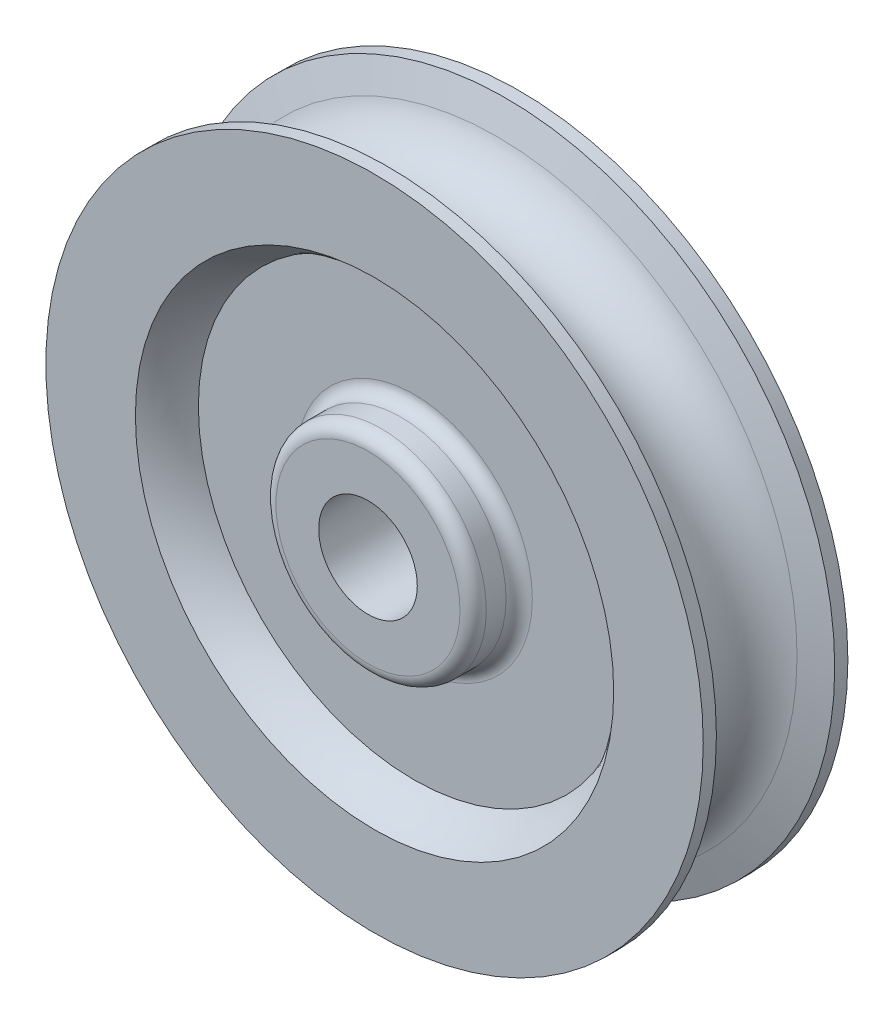
from build123d import *


with BuildPart() as part:
    # Sketch1 → Revolve1 (revolve)
    with BuildSketch(Plane(origin=(0, 0, 0), x_dir=(1, 0, 0), z_dir=(0, 1, 0))):
        with BuildLine():
            ThreePointArc((32.801315846, 17), (34.259680647, 20.197781656), (36.381049961, 23))
            Line((36.381049961, 23), (49.999989289, 23))
            Line((49.999989289, 23), (49.999989289, 21.000034438))
            Line((49.999989289, 21.000034438), (45.624111056, 19.639054374))
            ThreePointArc((45.624111056, 19.639054374), (40, 12), (45.624111056, 4.360945626))
            Line((45.624111056, 4.360945626), (49.999989289, 2.999965562))
            Line((49.999989289, 2.999965562), (49.999989289, 1))
            Line((49.999989289, 1), (36.381049961, 1))
            ThreePointArc((36.381049961, 1), (34.259680647, 3.802218344), (32.801315846, 7))
            Line((32.801315846, 7), (18, 7))
            ThreePointArc((18, 7), (16.585786438, 6.414213562), (16, 5))
            Line((16, 5), (16, 2))
            ThreePointArc((16, 2), (15.414213562, 0.585786438), (14, 0))
            Line((14, 0), (7.5, 0))
            Line((7.5, 0), (7.5, 12))
            Line((7.5, 12), (7.5, 24))
            Line((7.5, 24), (14, 24))
            ThreePointArc((14, 24), (15.414213562, 23.414213562), (16, 22))
            Line((16, 22), (16, 19))
            ThreePointArc((16, 19), (16.585786438, 17.585786438), (18, 17))
            Line((18, 17), (32.801315846, 17))
        make_face()
    revolve(axis=Axis((0, 0, 0), (0, 0, -1)))


solid = part.part
